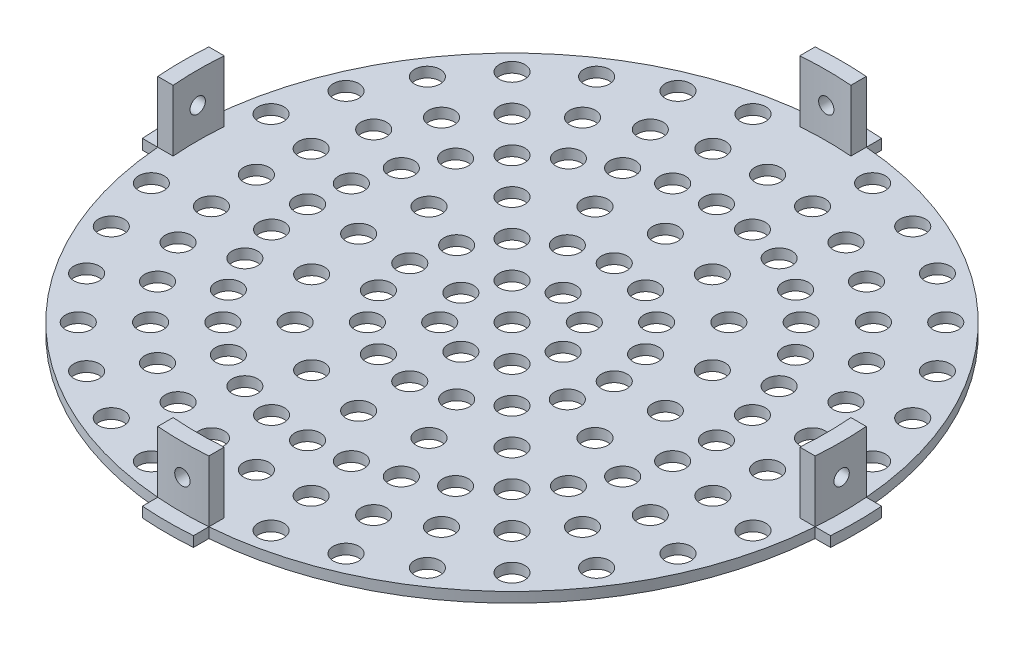
from build123d import *
from build123d.topology import SkipClean

# Parameters (mm, degrees)
CUT_EXTRUDE_START        = 10
CUT_EXTRUDE_2_DEPTH      = 10
SKETCH_3_R               = 2.5
CUT_EXTRUDE_4_DEPTH      = 97.480567992
CUT_EXTRUDE_START_2      = -12
CUT_EXTRUDE_5_DEPTH      = 12
SKETCH_5_R               = 1.5
CUT_EXTRUDE_6_DEPTH      = 97.480567992
PATTERN_CIRCULAR_1_COUNT = 4


with BuildPart() as part:
    # Эскиз1 → Повернуть1 (revolve)
    with BuildSketch(Plane.XY, mode=Mode.PRIVATE) as revolve_1_sk:
        Polygon((0, 0), (-67.5, 0), (-67.5, 2), (-64.5, 2), (-64.5, 14), (-61.5, 14), (-61.5, 2), (0, 2), align=None)
    revolve(revolve_1_sk.sketch.rotate(Axis((0, 0, 0), (0, 1, 0)), 270), axis=Axis((0, 0, 0), (0, 1, 0)))

    # Эскиз2 → Вырез-Вытянуть2 (cut)
    with SkipClean():  # the faces are left unmerged after this step: merging them gives an invalid solid
        with BuildSketch(Plane(origin=(0, 0, 0), x_dir=(1, 0, 0), z_dir=(0, 1, 0)).offset(CUT_EXTRUDE_START)):
            with BuildLine():
                ThreePointArc((-5, 67.314560089), (-47.72970773, 47.72970773), (-67.314560089, 5))
                Line((-67.314560089, 5), (-64.305909526, 5))
                ThreePointArc((-64.305909526, 5), (-45.608387387, 45.608387387), (-5, 64.305909526))
                Line((-5, 64.305909526), (-5, 67.314560089))
            make_face()
            with BuildLine():
                ThreePointArc((67.314560089, 5), (47.72970773, 47.72970773), (5, 67.314560089))
                Line((5, 67.314560089), (5, 64.305909526))
                ThreePointArc((5, 64.305909526), (45.608387387, 45.608387387), (64.305909526, 5))
                Line((64.305909526, 5), (67.314560089, 5))
            make_face()
            with BuildLine():
                Line((5, -64.305909526), (5, -67.314560089))
                ThreePointArc((5, -67.314560089), (47.72970773, -47.72970773), (67.314560089, -5))
                Line((67.314560089, -5), (64.305909526, -5))
                ThreePointArc((64.305909526, -5), (45.608387387, -45.608387387), (5, -64.305909526))
            make_face()
            with BuildLine():
                Line((-64.305909526, -5), (-67.314560089, -5))
                ThreePointArc((-67.314560089, -5), (-47.72970773, -47.72970773), (-5, -67.314560089))
                Line((-5, -67.314560089), (-5, -64.305909526))
                ThreePointArc((-5, -64.305909526), (-45.608387387, -45.608387387), (-64.305909526, -5))
            make_face()
        extrude(amount=-CUT_EXTRUDE_2_DEPTH, mode=Mode.SUBTRACT)

    # Эскиз3 → Вырез-Вытянуть4 (cut, through all)
    with SkipClean():  # the faces are left unmerged after this step: merging them gives an invalid solid
        with BuildSketch(Plane(origin=(0, 0, 0), x_dir=(1, 0, 0), z_dir=(0, 1, 0))):
            with Locations(Location((0, 0, 0), (0, 0, 90))):
                Circle(SKETCH_3_R)
            with Locations(Location((0, 10, 0), (0, 0, 90))):
                Circle(SKETCH_3_R)
            with Locations(Location((0, 20, 0), (0, 0, 90))):
                Circle(SKETCH_3_R)
            with Locations(Location((0, 30, 0), (0, 0, 90))):
                Circle(SKETCH_3_R)
            with Locations(Location((0, 40, 0), (0, 0, 90))):
                Circle(SKETCH_3_R)
            with Locations(Location((0, 50, 0), (0, 0, 90))):
                Circle(SKETCH_3_R)
            with Locations(Location((7.071067812, 7.071067812, 0), (0, 0, 90))):
                Circle(SKETCH_3_R)
            with Locations(Location((10, 0, 0), (0, 0, 90))):
                Circle(SKETCH_3_R)
            with Locations(Location((7.071067812, -7.071067812, 0), (0, 0, 90))):
                Circle(SKETCH_3_R)
            with Locations(Location((0, -10, 0), (0, 0, 90))):
                Circle(SKETCH_3_R)
            with Locations(Location((-7.071067812, -7.071067812, 0), (0, 0, 90))):
                Circle(SKETCH_3_R)
            with Locations(Location((-10, 0, 0), (0, 0, 90))):
                Circle(SKETCH_3_R)
            with Locations(Location((-7.071067812, 7.071067812, 0), (0, 0, 90))):
                Circle(SKETCH_3_R)
            with Locations(Location((7.653668647, 18.47759065, 0), (0, 0, 90))):
                Circle(SKETCH_3_R)
            with Locations(Location((14.142135624, 14.142135624, 0), (0, 0, 90))):
                Circle(SKETCH_3_R)
            with Locations(Location((18.47759065, 7.653668647, 0), (0, 0, 90))):
                Circle(SKETCH_3_R)
            with Locations(Location((20, 0, 0), (0, 0, 90))):
                Circle(SKETCH_3_R)
            with Locations(Location((18.47759065, -7.653668647, 0), (0, 0, 90))):
                Circle(SKETCH_3_R)
            with Locations(Location((14.142135624, -14.142135624, 0), (0, 0, 90))):
                Circle(SKETCH_3_R)
            with Locations(Location((7.653668647, -18.47759065, 0), (0, 0, 90))):
                Circle(SKETCH_3_R)
            with Locations(Location((0, -20, 0), (0, 0, 90))):
                Circle(SKETCH_3_R)
            with Locations(Location((-7.653668647, -18.47759065, 0), (0, 0, 90))):
                Circle(SKETCH_3_R)
            with Locations(Location((-14.142135624, -14.142135624, 0), (0, 0, 90))):
                Circle(SKETCH_3_R)
            with Locations(Location((-18.47759065, -7.653668647, 0), (0, 0, 90))):
                Circle(SKETCH_3_R)
            with Locations(Location((-20, 0, 0), (0, 0, 90))):
                Circle(SKETCH_3_R)
            with Locations(Location((-18.47759065, 7.653668647, 0), (0, 0, 90))):
                Circle(SKETCH_3_R)
            with Locations(Location((-14.142135624, 14.142135624, 0), (0, 0, 90))):
                Circle(SKETCH_3_R)
            with Locations(Location((-7.653668647, 18.47759065, 0), (0, 0, 90))):
                Circle(SKETCH_3_R)
            with Locations(Location((11.480502971, 27.716385975, 0), (0, 0, 90))):
                Circle(SKETCH_3_R)
            with Locations(Location((21.213203436, 21.213203436, 0), (0, 0, 90))):
                Circle(SKETCH_3_R)
            with Locations(Location((27.716385975, 11.480502971, 0), (0, 0, 90))):
                Circle(SKETCH_3_R)
            with Locations(Location((30, 0, 0), (0, 0, 90))):
                Circle(SKETCH_3_R)
            with Locations(Location((27.716385975, -11.480502971, 0), (0, 0, 90))):
                Circle(SKETCH_3_R)
            with Locations(Location((21.213203436, -21.213203436, 0), (0, 0, 90))):
                Circle(SKETCH_3_R)
            with Locations(Location((11.480502971, -27.716385975, 0), (0, 0, 90))):
                Circle(SKETCH_3_R)
            with Locations(Location((0, -30, 0), (0, 0, 90))):
                Circle(SKETCH_3_R)
            with Locations(Location((-11.480502971, -27.716385975, 0), (0, 0, 90))):
                Circle(SKETCH_3_R)
            with Locations(Location((-21.213203436, -21.213203436, 0), (0, 0, 90))):
                Circle(SKETCH_3_R)
            with Locations(Location((-27.716385975, -11.480502971, 0), (0, 0, 90))):
                Circle(SKETCH_3_R)
            with Locations(Location((-30, 0, 0), (0, 0, 90))):
                Circle(SKETCH_3_R)
            with Locations(Location((-27.716385975, 11.480502971, 0), (0, 0, 90))):
                Circle(SKETCH_3_R)
            with Locations(Location((-21.213203436, 21.213203436, 0), (0, 0, 90))):
                Circle(SKETCH_3_R)
            with Locations(Location((-11.480502971, 27.716385975, 0), (0, 0, 90))):
                Circle(SKETCH_3_R)
            with Locations(Location((-7.803612881, 39.231411216, 0), (0, 0, 90))):
                Circle(SKETCH_3_R)
            with Locations(Location((-9.754516101, 49.03926402, 0), (0, 0, 90))):
                Circle(SKETCH_3_R)
            with Locations(Location((-15.307337295, 36.9551813, 0), (0, 0, 90))):
                Circle(SKETCH_3_R)
            with Locations(Location((-19.134171618, 46.193976626, 0), (0, 0, 90))):
                Circle(SKETCH_3_R)
            with Locations(Location((-22.222809321, 33.258784492, 0), (0, 0, 90))):
                Circle(SKETCH_3_R)
            with Locations(Location((-27.778511651, 41.573480615, 0), (0, 0, 90))):
                Circle(SKETCH_3_R)
            with Locations(Location((-28.284271247, 28.284271247, 0), (0, 0, 90))):
                Circle(SKETCH_3_R)
            with Locations(Location((-35.355339059, 35.355339059, 0), (0, 0, 90))):
                Circle(SKETCH_3_R)
            with Locations(Location((-33.258784492, 22.222809321, 0), (0, 0, 90))):
                Circle(SKETCH_3_R)
            with Locations(Location((-41.573480615, 27.778511651, 0), (0, 0, 90))):
                Circle(SKETCH_3_R)
            with Locations(Location((-36.9551813, 15.307337295, 0), (0, 0, 90))):
                Circle(SKETCH_3_R)
            with Locations(Location((-46.193976626, 19.134171618, 0), (0, 0, 90))):
                Circle(SKETCH_3_R)
            with Locations(Location((-39.231411216, 7.803612881, 0), (0, 0, 90))):
                Circle(SKETCH_3_R)
            with Locations(Location((-49.03926402, 9.754516101, 0), (0, 0, 90))):
                Circle(SKETCH_3_R)
            with Locations(Location((-40, 0, 0), (0, 0, 90))):
                Circle(SKETCH_3_R)
            with Locations(Location((-50, 0, 0), (0, 0, 90))):
                Circle(SKETCH_3_R)
            with Locations(Location((-39.231411216, -7.803612881, 0), (0, 0, 90))):
                Circle(SKETCH_3_R)
            with Locations(Location((-49.03926402, -9.754516101, 0), (0, 0, 90))):
                Circle(SKETCH_3_R)
            with Locations(Location((-36.9551813, -15.307337295, 0), (0, 0, 90))):
                Circle(SKETCH_3_R)
            with Locations(Location((-46.193976626, -19.134171618, 0), (0, 0, 90))):
                Circle(SKETCH_3_R)
            with Locations(Location((-33.258784492, -22.222809321, 0), (0, 0, 90))):
                Circle(SKETCH_3_R)
            with Locations(Location((-41.573480615, -27.778511651, 0), (0, 0, 90))):
                Circle(SKETCH_3_R)
            with Locations(Location((-28.284271247, -28.284271247, 0), (0, 0, 90))):
                Circle(SKETCH_3_R)
            with Locations(Location((-35.355339059, -35.355339059, 0), (0, 0, 90))):
                Circle(SKETCH_3_R)
            with Locations(Location((-22.222809321, -33.258784492, 0), (0, 0, 90))):
                Circle(SKETCH_3_R)
            with Locations(Location((-27.778511651, -41.573480615, 0), (0, 0, 90))):
                Circle(SKETCH_3_R)
            with Locations(Location((-15.307337295, -36.9551813, 0), (0, 0, 90))):
                Circle(SKETCH_3_R)
            with Locations(Location((-19.134171618, -46.193976626, 0), (0, 0, 90))):
                Circle(SKETCH_3_R)
            with Locations(Location((-7.803612881, -39.231411216, 0), (0, 0, 90))):
                Circle(SKETCH_3_R)
            with Locations(Location((-9.754516101, -49.03926402, 0), (0, 0, 90))):
                Circle(SKETCH_3_R)
            with Locations(Location((0, -40, 0), (0, 0, 90))):
                Circle(SKETCH_3_R)
            with Locations(Location((0, -50, 0), (0, 0, 90))):
                Circle(SKETCH_3_R)
            with Locations(Location((7.803612881, -39.231411216, 0), (0, 0, 90))):
                Circle(SKETCH_3_R)
            with Locations(Location((9.754516101, -49.03926402, 0), (0, 0, 90))):
                Circle(SKETCH_3_R)
            with Locations(Location((15.307337295, -36.9551813, 0), (0, 0, 90))):
                Circle(SKETCH_3_R)
            with Locations(Location((19.134171618, -46.193976626, 0), (0, 0, 90))):
                Circle(SKETCH_3_R)
            with Locations(Location((22.222809321, -33.258784492, 0), (0, 0, 90))):
                Circle(SKETCH_3_R)
            with Locations(Location((27.778511651, -41.573480615, 0), (0, 0, 90))):
                Circle(SKETCH_3_R)
            with Locations(Location((28.284271247, -28.284271247, 0), (0, 0, 90))):
                Circle(SKETCH_3_R)
            with Locations(Location((35.355339059, -35.355339059, 0), (0, 0, 90))):
                Circle(SKETCH_3_R)
            with Locations(Location((33.258784492, -22.222809321, 0), (0, 0, 90))):
                Circle(SKETCH_3_R)
            with Locations(Location((41.573480615, -27.778511651, 0), (0, 0, 90))):
                Circle(SKETCH_3_R)
            with Locations(Location((36.9551813, -15.307337295, 0), (0, 0, 90))):
                Circle(SKETCH_3_R)
            with Locations(Location((46.193976626, -19.134171618, 0), (0, 0, 90))):
                Circle(SKETCH_3_R)
            with Locations(Location((39.231411216, -7.803612881, 0), (0, 0, 90))):
                Circle(SKETCH_3_R)
            with Locations(Location((49.03926402, -9.754516101, 0), (0, 0, 90))):
                Circle(SKETCH_3_R)
            with Locations(Location((40, 0, 0), (0, 0, 90))):
                Circle(SKETCH_3_R)
            with Locations(Location((50, 0, 0), (0, 0, 90))):
                Circle(SKETCH_3_R)
            with Locations(Location((39.231411216, 7.803612881, 0), (0, 0, 90))):
                Circle(SKETCH_3_R)
            with Locations(Location((49.03926402, 9.754516101, 0), (0, 0, 90))):
                Circle(SKETCH_3_R)
            with Locations(Location((36.9551813, 15.307337295, 0), (0, 0, 90))):
                Circle(SKETCH_3_R)
            with Locations(Location((46.193976626, 19.134171618, 0), (0, 0, 90))):
                Circle(SKETCH_3_R)
            with Locations(Location((33.258784492, 22.222809321, 0), (0, 0, 90))):
                Circle(SKETCH_3_R)
            with Locations(Location((41.573480615, 27.778511651, 0), (0, 0, 90))):
                Circle(SKETCH_3_R)
            with Locations(Location((28.284271247, 28.284271247, 0), (0, 0, 90))):
                Circle(SKETCH_3_R)
            with Locations(Location((35.355339059, 35.355339059, 0), (0, 0, 90))):
                Circle(SKETCH_3_R)
            with Locations(Location((22.222809321, 33.258784492, 0), (0, 0, 90))):
                Circle(SKETCH_3_R)
            with Locations(Location((27.778511651, 41.573480615, 0), (0, 0, 90))):
                Circle(SKETCH_3_R)
            with Locations(Location((15.307337295, 36.9551813, 0), (0, 0, 90))):
                Circle(SKETCH_3_R)
            with Locations(Location((19.134171618, 46.193976626, 0), (0, 0, 90))):
                Circle(SKETCH_3_R)
            with Locations(Location((7.803612881, 39.231411216, 0), (0, 0, 90))):
                Circle(SKETCH_3_R)
            with Locations(Location((9.754516101, 49.03926402, 0), (0, 0, 90))):
                Circle(SKETCH_3_R)
            with Locations(Location((-11.705419321, 58.847116824, 0), (0, 0, 47.170819838))):
                Circle(SKETCH_3_R)
            with Locations(Location((-22.961005942, 55.432771951, 0), (0, 0, 58.420819838))):
                Circle(SKETCH_3_R)
            with Locations(Location((-33.334213981, 49.888176738, 0), (0, 0, 69.670819838))):
                Circle(SKETCH_3_R)
            with Locations(Location((-42.426406871, 42.426406871, 0), (0, 0, 80.920819838))):
                Circle(SKETCH_3_R)
            with Locations(Location((-49.888176738, 33.334213981, 0), (0, 0, 92.170819838))):
                Circle(SKETCH_3_R)
            with Locations(Location((-55.432771951, 22.961005942, 0), (0, 0, 103.420819838))):
                Circle(SKETCH_3_R)
            with Locations(Location((-58.847116824, 11.705419321, 0), (0, 0, 114.670819838))):
                Circle(SKETCH_3_R)
            with Locations(Location((-58.847116824, -11.705419321, 0), (0, 0, 137.170819838))):
                Circle(SKETCH_3_R)
            with Locations(Location((-55.432771951, -22.961005942, 0), (0, 0, 148.420819838))):
                Circle(SKETCH_3_R)
            with Locations(Location((-49.888176738, -33.334213981, 0), (0, 0, 159.670819838))):
                Circle(SKETCH_3_R)
            with Locations(Location((-42.426406871, -42.426406871, 0), (0, 0, 170.920819838))):
                Circle(SKETCH_3_R)
            with Locations(Location((-33.334213981, -49.888176738, 0), (0, 0, 182.170819838))):
                Circle(SKETCH_3_R)
            with Locations(Location((-22.961005942, -55.432771951, 0), (0, 0, 193.420819838))):
                Circle(SKETCH_3_R)
            with Locations(Location((-11.705419321, -58.847116824, 0), (0, 0, 204.670819838))):
                Circle(SKETCH_3_R)
            with Locations(Location((11.705419321, -58.847116824, 0), (0, 0, 335.329180162))):
                Circle(SKETCH_3_R)
            with Locations(Location((22.961005942, -55.432771951, 0), (0, 0, 346.579180162))):
                Circle(SKETCH_3_R)
            with Locations(Location((33.334213981, -49.888176738, 0), (0, 0, 357.829180162))):
                Circle(SKETCH_3_R)
            with Locations(Location((42.426406871, -42.426406871, 0), (0, 0, 9.079180162))):
                Circle(SKETCH_3_R)
            with Locations(Location((49.888176738, -33.334213981, 0), (0, 0, 20.329180162))):
                Circle(SKETCH_3_R)
            with Locations(Location((55.432771951, -22.961005942, 0), (0, 0, 31.579180162))):
                Circle(SKETCH_3_R)
            with Locations(Location((58.847116824, -11.705419321, 0), (0, 0, 42.829180162))):
                Circle(SKETCH_3_R)
            with Locations(Location((58.847116824, 11.705419321, 0), (0, 0, 65.329180162))):
                Circle(SKETCH_3_R)
            with Locations(Location((55.432771951, 22.961005942, 0), (0, 0, 76.579180162))):
                Circle(SKETCH_3_R)
            with Locations(Location((49.888176738, 33.334213981, 0), (0, 0, 87.829180162))):
                Circle(SKETCH_3_R)
            with Locations(Location((42.426406871, 42.426406871, 0), (0, 0, 99.079180162))):
                Circle(SKETCH_3_R)
            with Locations(Location((33.334213981, 49.888176738, 0), (0, 0, 110.329180162))):
                Circle(SKETCH_3_R)
            with Locations(Location((22.961005942, 55.432771951, 0), (0, 0, 121.579180162))):
                Circle(SKETCH_3_R)
            with Locations(Location((11.705419321, 58.847116824, 0), (0, 0, 132.829180162))):
                Circle(SKETCH_3_R)
        extrude(amount=CUT_EXTRUDE_4_DEPTH, mode=Mode.SUBTRACT)

    # Эскиз4 → Вырез-Вытянуть5 (cut)
    with BuildSketch(Plane(origin=(0, 14, 0), x_dir=(1, 0, 0), z_dir=(0, 1, 0)).offset(CUT_EXTRUDE_START_2)):
        with BuildLine():
            ThreePointArc((-5, 64.305909526), (-45.608387387, 45.608387387), (-64.305909526, 5))
            Line((-64.305909526, 5), (-61.296410988, 5))
            ThreePointArc((-61.296410988, 5), (-43.487067043, 43.487067043), (-5, 61.296410988))
            Line((-5, 61.296410988), (-5, 64.305909526))
        make_face()
        with BuildLine():
            ThreePointArc((64.305909526, 5), (45.608387387, 45.608387387), (5, 64.305909526))
            Line((5, 64.305909526), (5, 61.296410988))
            ThreePointArc((5, 61.296410988), (43.487067043, 43.487067043), (61.296410988, 5))
            Line((61.296410988, 5), (64.305909526, 5))
        make_face()
        with BuildLine():
            Line((5, -61.296410988), (5, -64.305909526))
            ThreePointArc((5, -64.305909526), (45.608387387, -45.608387387), (64.305909526, -5))
            Line((64.305909526, -5), (61.296410988, -5))
            ThreePointArc((61.296410988, -5), (43.487067043, -43.487067043), (5, -61.296410988))
        make_face()
        with BuildLine():
            Line((-61.296410988, -5), (-64.305909526, -5))
            ThreePointArc((-64.305909526, -5), (-45.608387387, -45.608387387), (-5, -64.305909526))
            Line((-5, -64.305909526), (-5, -61.296410988))
            ThreePointArc((-5, -61.296410988), (-43.487067043, -43.487067043), (-61.296410988, -5))
        make_face()
    extrude(amount=CUT_EXTRUDE_5_DEPTH, mode=Mode.SUBTRACT)

    # Эскиз5 → Вырез-Вытянуть6 (cut, through all)
    with BuildSketch(Plane.XY):
        with Locations((0, 8)):
            Circle(SKETCH_5_R)
    cut_extrude_6 = extrude(amount=-CUT_EXTRUDE_6_DEPTH, mode=Mode.SUBTRACT)

    # Круговой массив1: Вырез-Вытянуть6 ×4 about axis
    pattern_circular_1_axis = Axis((0, 0, 0), (0, -1, 0))
    for i in range(1, PATTERN_CIRCULAR_1_COUNT):
        add(cut_extrude_6.rotate(pattern_circular_1_axis, i * 360 / PATTERN_CIRCULAR_1_COUNT), mode=Mode.SUBTRACT)


solid = part.part
